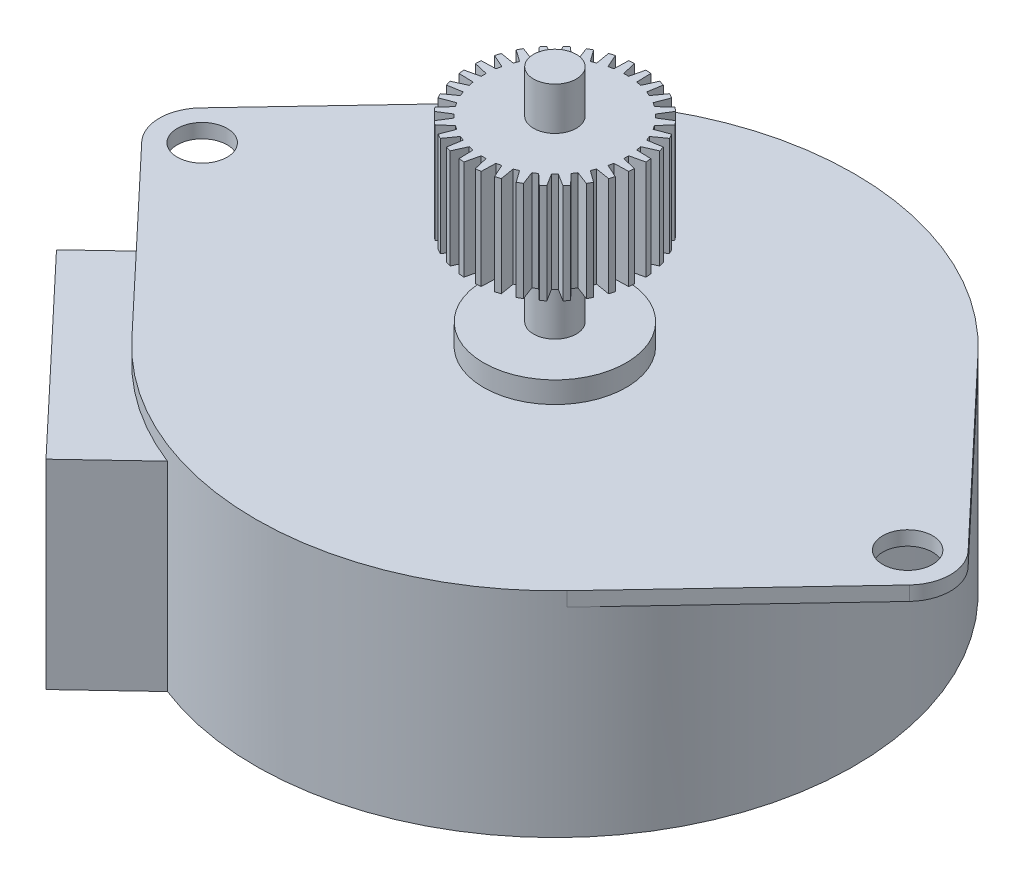
from build123d import *

# Parameters (mm, degrees)
EXTRUDE_1_DEPTH          = 1
EXTRUDE_START            = 14
SKETCH_2_R               = 21
EXTRUDE_2_DEPTH          = 14
EXTRUDE_3_DEPTH          = 4
EXTRUDE_3_DEPTH_BACK     = 14
SKETCH_3_W               = 18
SKETCH_3_H               = 14
SKETCH_4_R               = 1.75
CUT_EXTRUDE_1_DEPTH      = 4
SKETCH_5_R               = 5
EXTRUDE_4_DEPTH          = 1.5
SKETCH_6_R               = 1.5
EXTRUDE_5_DEPTH          = 15.5
SKETCH_8_R               = 6
EXTRUDE_6_DEPTH          = 7
CUT_EXTRUDE_2_DEPTH      = 7
PATTERN_CIRCULAR_1_COUNT = 32


with BuildPart() as part:
    # 스케치1 → 보스-돌출1 (new body)
    with BuildSketch(Plane(origin=(0, 0, 0), x_dir=(1, 0, 0), z_dir=(0, 1, 0))):
        with BuildLine():
            Line((15.272727273, 14.413320286), (26.931818182, 2.059045755))
            ThreePointArc((26.931818182, 2.059045755), (27.75, 0), (26.931818182, -2.059045755))
            Line((26.931818182, -2.059045755), (15.272727273, -14.413320286))
            ThreePointArc((15.272727273, -14.413320286), (0, -21), (-15.272727273, -14.413320286))
            Line((-15.272727273, -14.413320286), (-26.931818182, -2.059045755))
            ThreePointArc((-26.931818182, -2.059045755), (-27.75, 0), (-26.931818182, 2.059045755))
            Line((-26.931818182, 2.059045755), (-15.272727273, 14.413320286))
            ThreePointArc((-15.272727273, 14.413320286), (0, 21), (15.272727273, 14.413320286))
        make_face()
    extrude(amount=EXTRUDE_1_DEPTH)

    # 스케치2 → 보스-돌출2 (add)
    with BuildSketch(Plane.XZ.offset(EXTRUDE_START)):
        with Locations(Location((0, 0, 0), (0, 0, 270))):
            Circle(SKETCH_2_R)
    extrude(amount=-EXTRUDE_2_DEPTH)

    # 스케치3 → 보스-돌출3 (add, two sides: drawn at the far end of the back side and taken through both)
    with BuildSketch(Plane(origin=(-15.272727273, 0, 14.413320286), x_dir=(0.6863485850246138, 0, 0.7272727272727271), z_dir=(-0.7272727272727271, 0, 0.6863485850246138)).offset(-EXTRUDE_3_DEPTH_BACK)):
        with Locations((0, -7)):
            Rectangle(SKETCH_3_W, SKETCH_3_H)
    extrude(amount=EXTRUDE_3_DEPTH + EXTRUDE_3_DEPTH_BACK)

    # 스케치4 → 컷-돌출1 (cut)
    with BuildSketch(Plane(origin=(0, 1, 0), x_dir=(1, 0, 0), z_dir=(0, 1, 0))):
        with Locations(Location((24.75, 0, 0), (0, 0, 270))):
            Circle(SKETCH_4_R)
        with Locations(Location((-24.75, 0, 0), (0, 0, 270))):
            Circle(SKETCH_4_R)
    extrude(amount=-CUT_EXTRUDE_1_DEPTH, mode=Mode.SUBTRACT)

    # 스케치5 → 보스-돌출4 (add)
    with BuildSketch(Plane(origin=(0, 1, 0), x_dir=(1, 0, 0), z_dir=(0, 1, 0))):
        with Locations(Location((0, 0, 0), (0, 0, 270))):
            Circle(SKETCH_5_R)
    extrude(amount=EXTRUDE_4_DEPTH)

    # 스케치6 → 보스-돌출5 (add)
    with BuildSketch(Plane(origin=(0, 2.5, 0), x_dir=(1, 0, 0), z_dir=(0, 1, 0))):
        with Locations(Location((0, 0, 0), (0, 0, 270))):
            Circle(SKETCH_6_R)
    extrude(amount=EXTRUDE_5_DEPTH)


with BuildPart() as body_2:
    # 스케치8 → 보스-돌출6 (new body)
    with BuildSketch(Plane(origin=(0, 15, 0), x_dir=(1, 0, 0), z_dir=(0, 1, 0))):
        with Locations(Location((0, 0, 0), (0, 0, 270))):
            Circle(SKETCH_8_R)
    extrude(amount=-EXTRUDE_6_DEPTH)

    # 스케치9 → 컷-돌출2 (cut)
    with BuildSketch(Plane(origin=(0, 15, 0), x_dir=(1, 0, 0), z_dir=(0, 1, 0))):
        Polygon((0, 5), (0.173304385, 5), (0.4, 5.986651819), (0, 6.45389359), (-0.4, 5.986651819), (-0.173304385, 5), align=None)
    cut_extrude_2 = extrude(amount=-CUT_EXTRUDE_2_DEPTH, mode=Mode.SUBTRACT)

    # 원형 패턴1: 컷-돌출2 ×32 about axis
    pattern_circular_1_axis = Axis((0, 0, 0), (0, 1, 0))
    for i in range(1, PATTERN_CIRCULAR_1_COUNT):
        add(cut_extrude_2.rotate(pattern_circular_1_axis, i * 360 / PATTERN_CIRCULAR_1_COUNT), mode=Mode.SUBTRACT)


solid = Compound([part.part, body_2.part])
